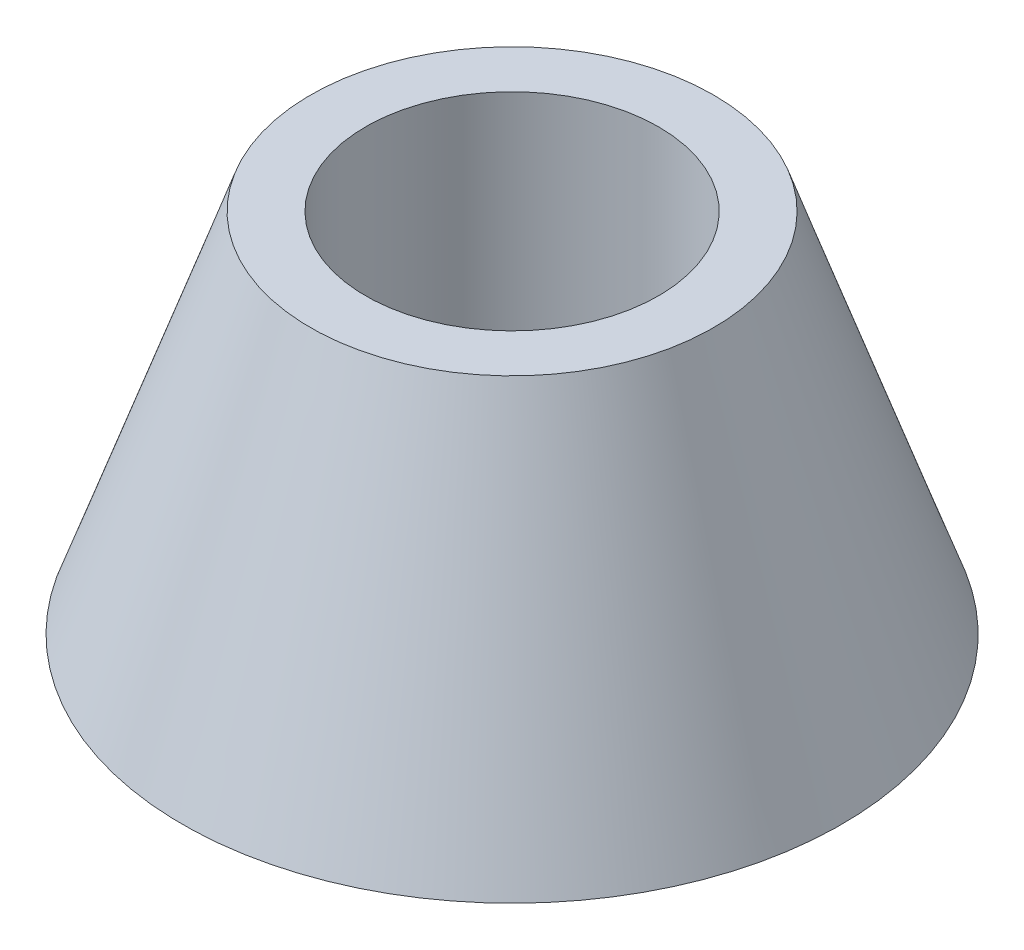
from build123d import *


with BuildPart() as part:
    # Sketch1 → Revolve1 (revolve)
    with BuildSketch(Plane.XY):
        Polygon((-4.3688, 7.9375), (-7.14375, 0), (-3.175, 0), (-3.175, 7.9375), align=None)
    revolve(axis=Axis((0, 0, 0), (0, 1, 0)))


solid = part.part
